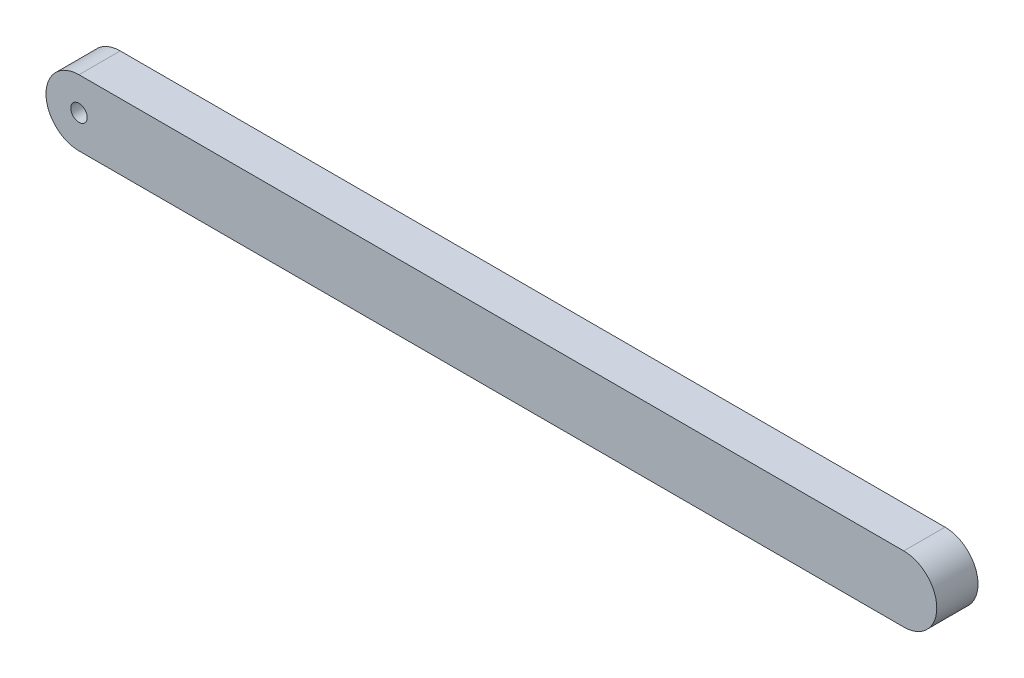
from build123d import *

# Parameters (mm, degrees)
SKETCH2_R           = 10
BOSS_EXTRUDE1_DEPTH = 50


with BuildPart() as part:
    # Sketch2 → Boss-Extrude1 (new body)
    with BuildSketch(Plane.XY):
        with BuildLine():
            Line((0, 40), (1000, 40))
            ThreePointArc((1000, 40), (1040, 0), (1000, -40))
            Line((1000, -40), (0, -40))
            ThreePointArc((0, -40), (-40, 0), (0, 40))
        make_face()
        Circle(SKETCH2_R, mode=Mode.SUBTRACT)
    extrude(amount=-BOSS_EXTRUDE1_DEPTH)


solid = part.part
